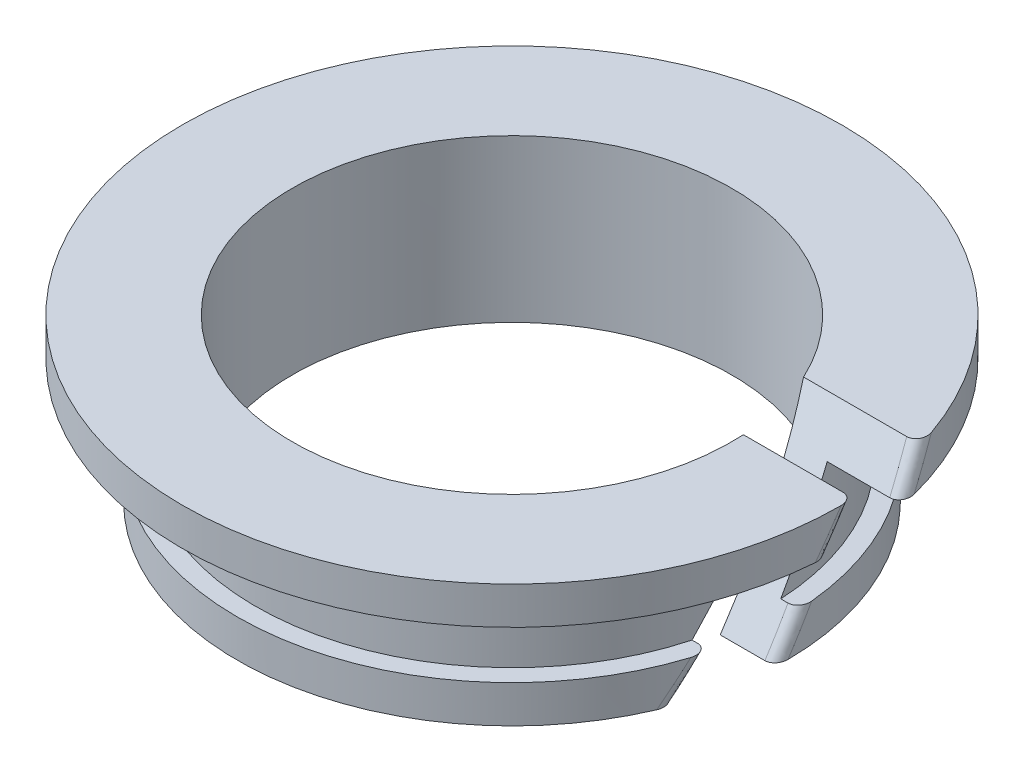
from build123d import *

# Parameters (mm, degrees)
CUT_EXTRUDE1_DEPTH = 11.693584767
FILLET1_R          = 0.2286


with BuildPart() as part:
    # Sketch1 → Revolve1 (revolve)
    with BuildSketch(Plane.XY, mode=Mode.PRIVATE) as revolve1_sk:
        Polygon((4.7625, 0), (5.953125, 0), (5.953125, 0.8128), (5.55625, 0.8128), (5.55625, 2.6924), (7.14375, 2.6924), (7.14375, 3.5052), (4.7625, 3.5052), align=None)
    revolve(revolve1_sk.sketch.rotate(Axis((0, 18.790103573, 0), (0, -1, 0)), 90), axis=Axis((0, 18.790103573, 0), (0, -1, 0)))

    # Sketch2 → Cut-Extrude1 (cut, through all)
    with BuildSketch(Plane(origin=(0, 0, 0), x_dir=(0, 0, -1), z_dir=(1, 0, 0))):
        Polygon((1.996034078, 3.5052), (0.261163337, 3.5052), (-1.977379553, 0), (-0.242508813, 0), align=None)
    extrude(amount=CUT_EXTRUDE1_DEPTH, mode=Mode.SUBTRACT)

    # Fillet1
    fillet1_edges = [part.edges().sort_by_distance(p)[0] for p in [
        (5.699722818, 0.405539452, 1.718387925),
        (7.143749816, 3.098800486, -0.001622443),
        (5.953100621, 0.406407356, -0.017037089),
        (6.929392139, 3.099377561, -1.736861724),
    ]]
    fillet(fillet1_edges, radius=FILLET1_R)


solid = part.part
